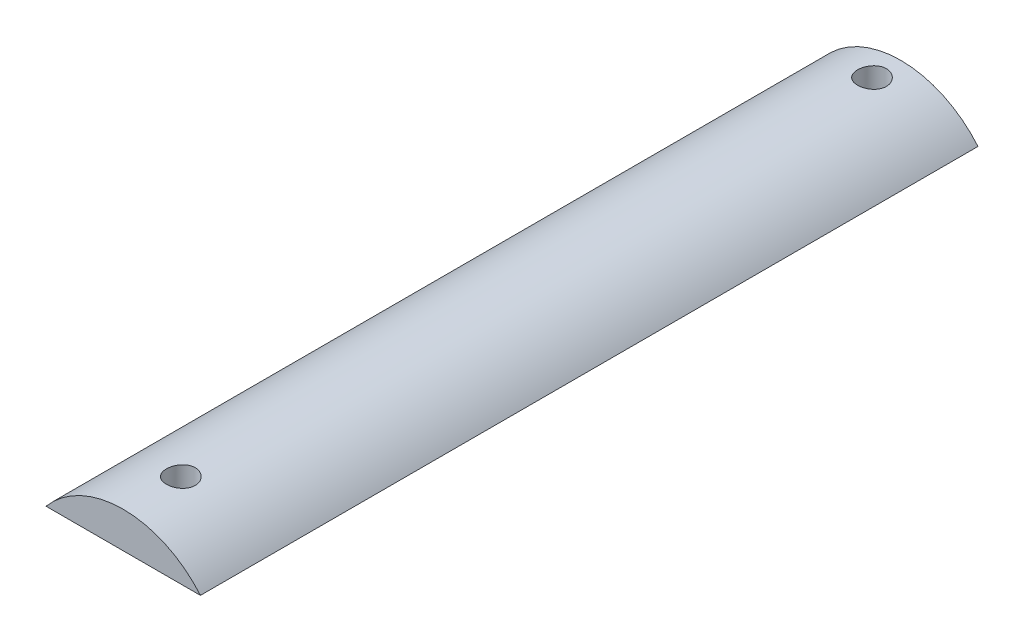
from build123d import *

# Parameters (mm, degrees)
BOSS_EXTRUDE1_DEPTH = 54
CUT_EXTRUDE1_DEPTH  = 1
SKETCH3_R           = 1
CUT_EXTRUDE2_DEPTH  = 55.286278193


with BuildPart() as part:
    # Sketch1 → Boss-Extrude1 (new body)
    with BuildSketch(Plane.XY):
        with BuildLine():
            ThreePointArc((5.361902647, 4.5), (0, 7), (-5.361902647, 4.5))
            Line((-5.361902647, 4.5), (5.361902647, 4.5))
        make_face()
    extrude(amount=BOSS_EXTRUDE1_DEPTH)

    # Sketch2 → Cut-Extrude1 (cut)
    with BuildSketch(Plane.XZ.offset(-4.5)):
        Polygon((2.309401077, 50), (1.154700538, 52), (-1.154700538, 52), (-2.309401077, 50), (-1.154700538, 48), (1.154700538, 48), align=None)
        Polygon((2.309401077, 2), (1.154700538, 4), (-1.154700538, 4), (-2.309401077, 2), (-1.154700538, 0), (1.154700538, 0), align=None)
    extrude(amount=-CUT_EXTRUDE1_DEPTH, mode=Mode.SUBTRACT)

    # Sketch3 → Cut-Extrude2 (cut, through all)
    with BuildSketch(Plane.XZ.offset(-5.5)):
        with Locations(Location((0, 2, 0), (0, 0, 270))):
            Circle(SKETCH3_R)
        with Locations(Location((0, 50, 0), (0, 0, 270))):
            Circle(SKETCH3_R)
    extrude(amount=-CUT_EXTRUDE2_DEPTH, mode=Mode.SUBTRACT)


solid = part.part
